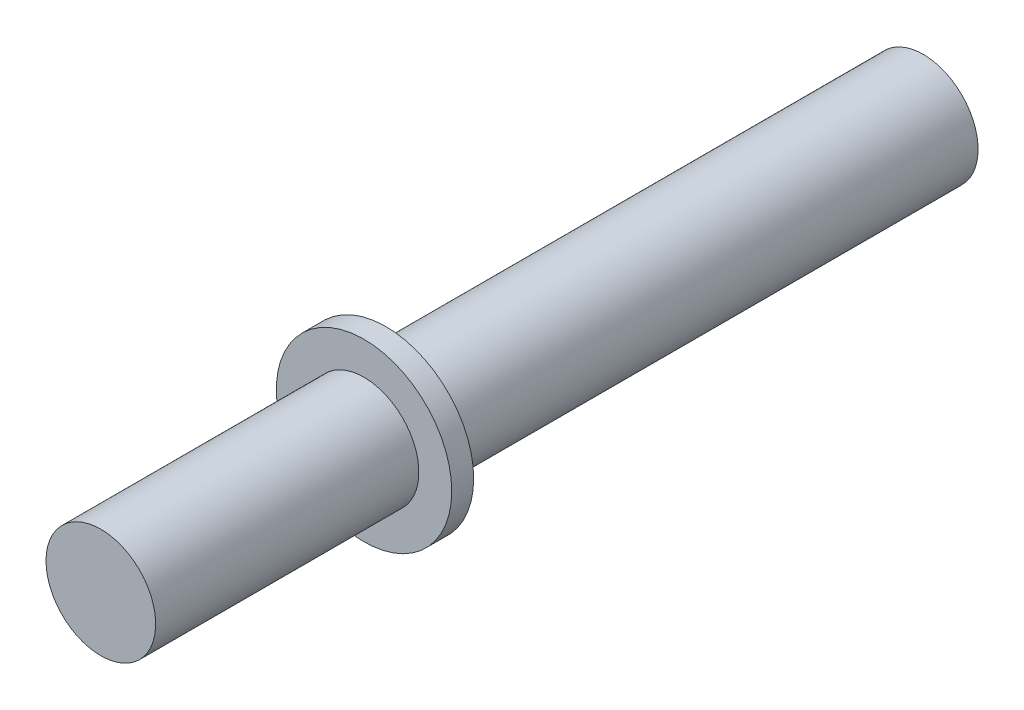
from build123d import *

# Parameters (mm, degrees)
PLUNGER_STEM_START     = 21.5
SKETCH1_R              = 1.5
PLUNGER_STEM_DEPTH     = 22.5
CAPTIVE_SHOULDER_START = 36.2
SKETCH2_R              = 2.4
CAPTIVE_SHOULDER_DEPTH = 0.6


with BuildPart() as part:
    # Sketch1 → Plunger_stem (new body)
    with BuildSketch(Plane.XY.offset(PLUNGER_STEM_START)):
        with Locations(Location((-32.018684277, -41.745416557, 0), (0, 0, 180))):
            Circle(SKETCH1_R)
    extrude(amount=PLUNGER_STEM_DEPTH)

    # Sketch2 → Captive_shoulder (add)
    with BuildSketch(Plane.XY.offset(CAPTIVE_SHOULDER_START)):
        with Locations((-32.018684277, -41.745416557)):
            Circle(SKETCH2_R)
    extrude(amount=CAPTIVE_SHOULDER_DEPTH)


solid = part.part
